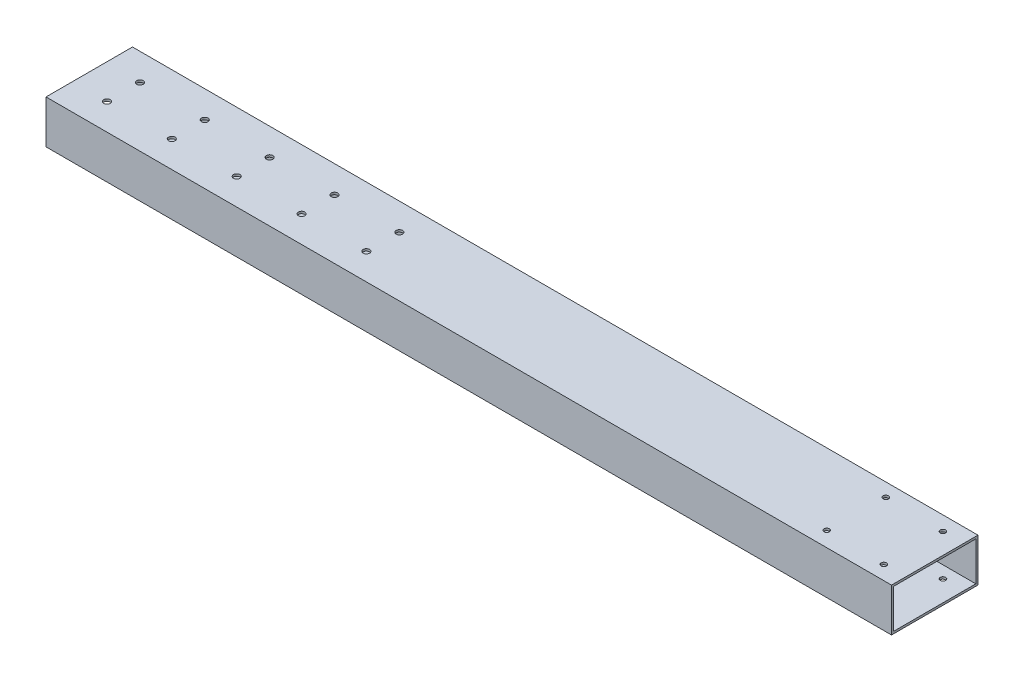
from build123d import *

# Parameters (mm, degrees)
SKETCH_1_W          = 40
SKETCH_1_H          = 20
EXTRUDE_1_DEPTH     = 391
SHELL_1_T           = -1
SKETCH_2_R          = 1.5
CUT_EXTRUDE_1_DEPTH = 48
SKETCH_3_R          = 1.25
CUT_EXTRUDE_2_DEPTH = 37


with BuildPart() as part:
    # 草图1 → 凸台-拉伸1 (new body)
    with BuildSketch(Plane(origin=(0, 0, 0), x_dir=(0, 0, -1), z_dir=(1, 0, 0))):
        Rectangle(SKETCH_1_W, SKETCH_1_H)
    extrude(amount=EXTRUDE_1_DEPTH)

    # 抽壳1
    shell_1_openings = [part.faces().sort_by_distance(p)[0] for p in [
        (391, 0, 0),
        (0, 0, 0),
    ]]
    offset(amount=SHELL_1_T, openings=shell_1_openings, kind=Kind.INTERSECTION)

    # 草图2 → 切除-拉伸1 (cut)
    with BuildSketch(Plane(origin=(0, 10, 0), x_dir=(1, 0, 0), z_dir=(0, 1, 0))):
        with Locations(Location((15.921137183, 7.495400719, 0), (0, 0, 270))):
            Circle(SKETCH_2_R)
        with Locations(Location((45.921137183, 7.495400719, 0), (0, 0, 270))):
            Circle(SKETCH_2_R)
        with Locations(Location((75.921137183, 7.495400719, 0), (0, 0, 270))):
            Circle(SKETCH_2_R)
        with Locations(Location((105.921137183, 7.495400719, 0), (0, 0, 270))):
            Circle(SKETCH_2_R)
        with Locations(Location((135.921137183, 7.495400719, 0), (0, 0, 270))):
            Circle(SKETCH_2_R)
        with Locations(Location((15.921137183, -7.735756338, 0), (0, 0, 270))):
            Circle(SKETCH_2_R)
        with Locations(Location((45.921137183, -7.735756338, 0), (0, 0, 270))):
            Circle(SKETCH_2_R)
        with Locations(Location((75.921137183, -7.735756338, 0), (0, 0, 270))):
            Circle(SKETCH_2_R)
        with Locations(Location((105.921137183, -7.735756338, 0), (0, 0, 270))):
            Circle(SKETCH_2_R)
        with Locations(Location((135.921137183, -7.735756338, 0), (0, 0, 270))):
            Circle(SKETCH_2_R)
    extrude(amount=-CUT_EXTRUDE_1_DEPTH, mode=Mode.SUBTRACT)

    # 草图3 → 切除-拉伸2 (cut)
    with BuildSketch(Plane.XZ.offset(10)):
        with Locations(Location((354.561034917, -13.835401739, 0), (0, 0, 270))):
            Circle(SKETCH_3_R)
        with Locations(Location((381.426907587, -13.361180576, 0), (0, 0, 270))):
            Circle(SKETCH_3_R)
        with Locations(Location((380.952686425, 13.504692093, 0), (0, 0, 270))):
            Circle(SKETCH_3_R)
        with Locations(Location((354.086813755, 13.030470931, 0), (0, 0, 270))):
            Circle(SKETCH_3_R)
    extrude(amount=-CUT_EXTRUDE_2_DEPTH, mode=Mode.SUBTRACT)


solid = part.part
